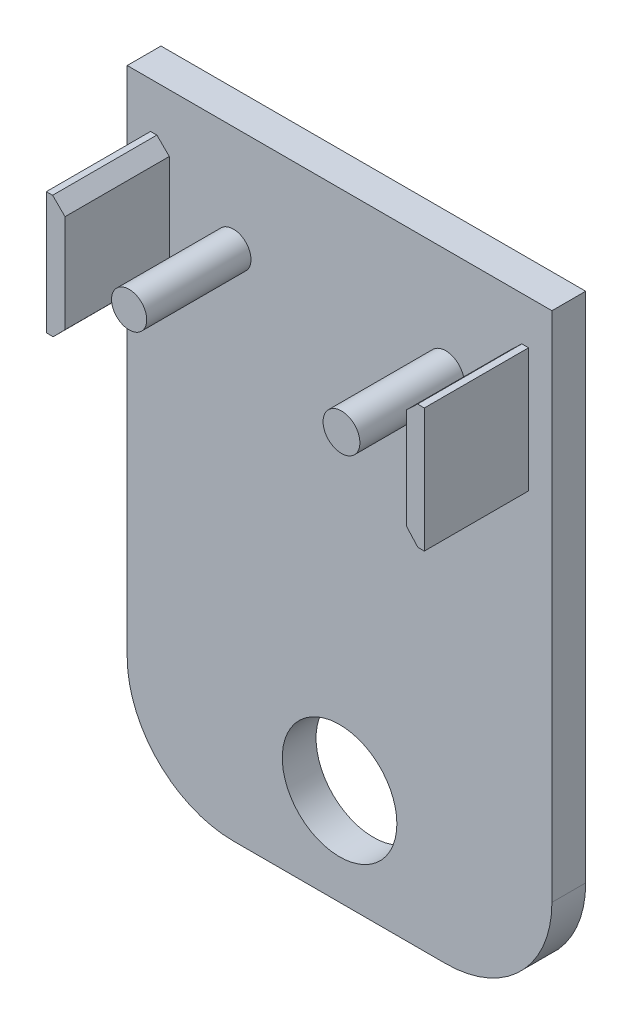
from build123d import *

# Parameters (mm, degrees)
BOSS_EXTRUDE1_START = -18.343704
SKETCH1_W           = 40
SKETCH1_H           = 58.259460065
SKETCH1_R           = 5.396381747
BOSS_EXTRUDE1_DEPTH = 3.18
FILLET1_R           = 10
SKETCH2_R           = 1.735008093
SKETCH2_R_2         = 1.656779544
BOSS_EXTRUDE2_DEPTH = 13


with BuildPart() as part:
    # Sketch1 → Boss-Extrude1 (new body)
    with BuildSketch(Plane.XY.offset(BOSS_EXTRUDE1_START)):
        with Locations((-57, -29.129730033)):
            Rectangle(SKETCH1_W, SKETCH1_H)
        with Locations((-57, -49.150000002)):
            Circle(SKETCH1_R, mode=Mode.SUBTRACT)
    extrude(amount=-BOSS_EXTRUDE1_DEPTH)

    # Fillet1
    fillet1_edges = [part.edges().sort_by_distance(p)[0] for p in [
        (-37, -58.259460066, -19.933704),
        (-77, -58.259460066, -19.933704),
    ]]
    fillet(fillet1_edges, radius=FILLET1_R)

    # Sketch2 → Boss-Extrude2 (add)
    with BuildSketch(Plane(origin=(0, 0, -21.523704006), x_dir=(-1, 0, 0), z_dir=(0, 0, -1))):
        with Locations((47.000000001, -10.000000002)):
            Circle(SKETCH2_R)
        with Locations((67.000376739, -10.000360351)):
            Circle(SKETCH2_R_2)
        Polygon((74.800685175, -15.79650853), (74.800685175, -4.278676416), (74.207239255, -4.278676416), (73.035580783, -5.437870437), (73.035580783, -14.663272101), (74.156761506, -15.79650853), align=None)
        Polygon((39.198491865, -15.79650853), (39.198491865, -4.122433506), (39.836367638, -4.122433506), (40.870792952, -5.11185736), (40.870792952, -14.618450275), (39.807051778, -15.79650853), align=None)
    extrude(amount=-BOSS_EXTRUDE2_DEPTH)


solid = part.part
